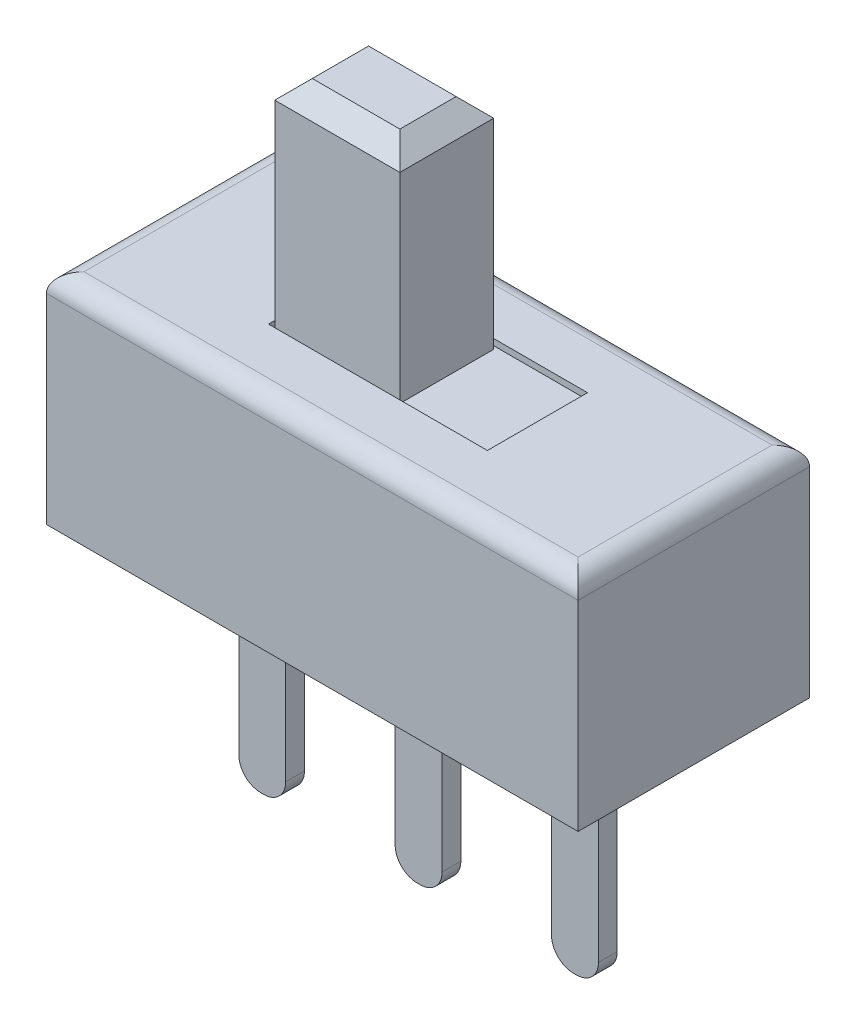
from build123d import *

# Parameters (mm, degrees)
SKETCH1_W           = 8.5
SKETCH1_H           = 3.7
BOSS_EXTRUDE1_DEPTH = 1.75
SKETCH2_W           = 3.5
SKETCH2_H           = 1.6
CUT_EXTRUDE1_DEPTH  = 0.1
SKETCH3_W           = 2
SKETCH3_H           = 1.5
BOSS_EXTRUDE2_DEPTH = 3.5
SKETCH4_W           = 0.75
SKETCH4_H           = 0.3
BOSS_EXTRUDE3_DEPTH = 3.7
CHAMFER1_SIZE       = 0.3
FILLET1_R           = 0.3
FILLET2_R           = 0.35


with BuildPart() as part:
    # Sketch1 → Boss-Extrude1 (new, symmetric)
    with BuildSketch(Plane(origin=(0, 0, 0), x_dir=(1, 0, 0), z_dir=(0, 1, 0))):
        Rectangle(SKETCH1_W, SKETCH1_H)
    extrude(amount=BOSS_EXTRUDE1_DEPTH, both=True)

    # Sketch2 → Cut-Extrude1 (cut)
    with BuildSketch(Plane(origin=(0, 1.75, 0), x_dir=(1, 0, 0), z_dir=(0, 1, 0))):
        Rectangle(SKETCH2_W, SKETCH2_H)
    extrude(amount=-CUT_EXTRUDE1_DEPTH, mode=Mode.SUBTRACT)

    # Sketch3 → Boss-Extrude2 (add)
    with BuildSketch(Plane(origin=(0, 1.65, 0), x_dir=(1, 0, 0), z_dir=(0, 1, 0))):
        with Locations((-0.7, 0)):
            Rectangle(SKETCH3_W, SKETCH3_H)
    extrude(amount=BOSS_EXTRUDE2_DEPTH)

    # Sketch4 → Boss-Extrude3 (add)
    with BuildSketch(Plane.XZ.offset(1.75)):
        Rectangle(SKETCH4_W, SKETCH4_H)
        with Locations((-2.5, 0)):
            Rectangle(SKETCH4_W, SKETCH4_H)
        with Locations((2.5, 0)):
            Rectangle(SKETCH4_W, SKETCH4_H)
    extrude(amount=BOSS_EXTRUDE3_DEPTH)

    # Chamfer1
    chamfer1_edges = [part.edges().sort_by_distance(p)[0] for p in [
        (-1.7, 5.15, 0),
        (-0.7, 5.15, 0.75),
        (0.3, 5.15, 0),
        (-0.7, 5.15, -0.75),
    ]]
    chamfer(chamfer1_edges, length=CHAMFER1_SIZE)

    # Fillet1
    fillet1_edges = [part.edges().sort_by_distance(p)[0] for p in [
        (-4.25, 1.75, 0),
        (0, 1.75, 1.85),
        (4.25, 1.75, 0),
        (0, 1.75, -1.85),
    ]]
    fillet(fillet1_edges, radius=FILLET1_R)

    # Fillet2
    fillet2_edges = [part.edges().sort_by_distance(p)[0] for p in [
        (0.375, -5.45, 0),
        (-0.375, -5.45, 0),
        (-2.125, -5.45, 0),
        (-2.875, -5.45, 0),
        (2.125, -5.45, 0),
        (2.875, -5.45, 0),
    ]]
    fillet(fillet2_edges, radius=FILLET2_R)


solid = part.part
